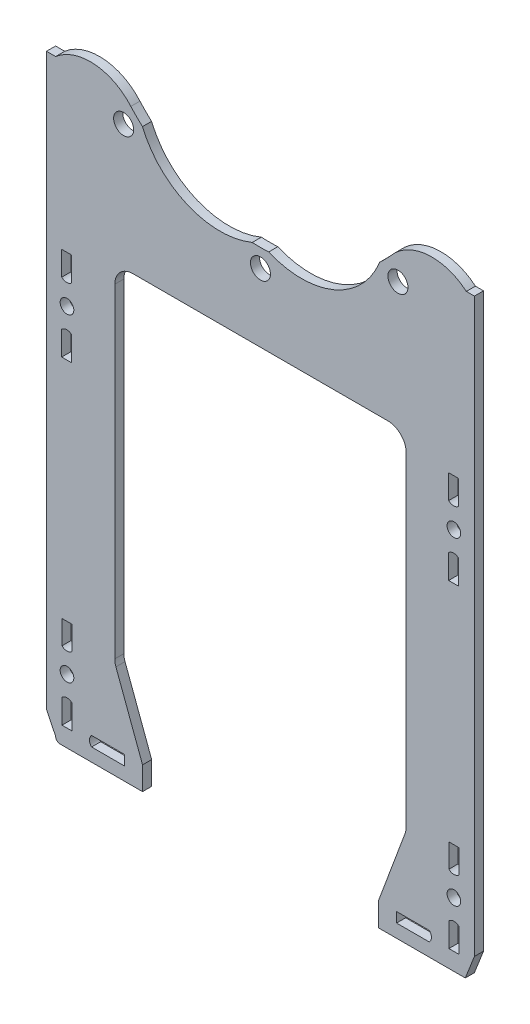
from build123d import *

# Parameters (mm, degrees)
SKETCH_3_R      = 2.2
SKETCH_3_R_2    = 1.5
EXTRUDE_1_DEPTH = 2


with BuildPart() as part:
    # 草图3 → 凸台-拉伸1 (new body)
    with BuildSketch(Plane.XY):
        with BuildLine():
            Line((-47, 31.317051182), (-47, -93.890216685))
            Line((-47, -93.890216685), (-45, -97.990216685))
            ThreePointArc((-45, -97.990216685), (-44.707106781, -98.697323466), (-44, -98.990216685))
            Line((-44, -98.990216685), (-25.9, -98.990216685))
            Line((-25.9, -98.990216685), (-25.9, -97.990216685))
            Line((-25.9, -97.990216685), (-25.9, -93.890216685))
            Line((-25.9, -93.890216685), (-31.748789112, -78.174983751))
            ThreePointArc((-31.748789112, -78.174983751), (-31.936696359, -77.488601938), (-32, -76.779784772))
            Line((-32, -76.779784772), (-32, -5.5))
            ThreePointArc((-32, -5.5), (-30.828427125, -2.671572875), (-28, -1.5))
            Line((-28, -1.5), (28, -1.5))
            ThreePointArc((28, -1.5), (30.828427125, -2.671572875), (32, -5.5))
            Line((32, -5.5), (32, -76.779784772))
            ThreePointArc((32, -76.779784772), (31.936696359, -77.488601938), (31.748789112, -78.174983751))
            Line((31.748789112, -78.174983751), (25.9, -93.890216685))
            Line((25.9, -93.890216685), (25.9, -97.990216685))
            Line((25.9, -97.990216685), (25.9, -98.990216685))
            Line((25.9, -98.990216685), (45, -98.990216685))
            Line((45, -98.990216685), (47, -93.890216685))
            Line((47, -93.890216685), (47, 31.741152315))
            Line((47, 31.741152315), (45.230037269, 31.741152315))
            ThreePointArc((45.230037269, 31.741152315), (36.686440181, 34.468680322), (28.716551195, 30.356098435))
            ThreePointArc((28.716551195, 30.356098435), (27.478316584, 29.033500084), (26.179230338, 27.770619934))
            ThreePointArc((26.179230338, 27.770619934), (16.152230905, 17.515551518), (1.809761925, 17.542559084))
            ThreePointArc((1.809761925, 17.542559084), (0, 17.5), (-1.809761925, 17.542559084))
            ThreePointArc((-1.809761925, 17.542559084), (-15.928828372, 17.542283516), (-25.912710857, 27.525776288))
            ThreePointArc((-25.912710857, 27.525776288), (-27.223611076, 28.776388924), (-28.474223712, 30.087289143))
            ThreePointArc((-28.474223712, 30.087289143), (-36.482419799, 34.124770496), (-45, 31.317051182))
            Line((-45, 31.317051182), (-47, 31.317051182))
        make_face()
        with Locations((0, 13.5)):
            Circle(SKETCH_3_R, mode=Mode.SUBTRACT)
        with Locations((-30.052038202, 25.947961669)):
            Circle(SKETCH_3_R, mode=Mode.SUBTRACT)
        with Locations((30.199957913, 26.082571452)):
            Circle(SKETCH_3_R, mode=Mode.SUBTRACT)
        with Locations((42.5, -14.940216685)):
            Circle(SKETCH_3_R_2, mode=Mode.SUBTRACT)
        with Locations(Location((-42.5, -14.940216685, 0), (0, 0, 180))):
            Circle(SKETCH_3_R_2, mode=Mode.SUBTRACT)
        with Locations((42.5, -84.940216685)):
            Circle(SKETCH_3_R_2, mode=Mode.SUBTRACT)
        with Locations((-42.5, -84.940216685)):
            Circle(SKETCH_3_R_2, mode=Mode.SUBTRACT)
        with BuildLine():
            Line((-37.1, -96.090216685), (-29.9, -96.090216685))
            Line((-29.9, -96.090216685), (-29.9, -93.890216685))
            Line((-29.9, -93.890216685), (-37.1, -93.890216685))
            ThreePointArc((-37.1, -93.890216685), (-37.555634919, -94.990216685), (-37.1, -96.090216685))
        make_face(mode=Mode.SUBTRACT)
        with BuildLine():
            Line((-41.45513954, -19.890216685), (-41.45513954, -25.190216685))
            Line((-41.45513954, -25.190216685), (-43.65513954, -25.190216685))
            Line((-43.65513954, -25.190216685), (-43.65513954, -19.890216685))
            ThreePointArc((-43.65513954, -19.890216685), (-42.55513954, -19.434581767), (-41.45513954, -19.890216685))
        make_face(mode=Mode.SUBTRACT)
        with BuildLine():
            Line((37.1, -93.890216685), (29.9, -93.890216685))
            Line((29.9, -93.890216685), (29.9, -96.090216685))
            Line((29.9, -96.090216685), (37.1, -96.090216685))
            ThreePointArc((37.1, -96.090216685), (37.555634919, -94.990216685), (37.1, -93.890216685))
        make_face(mode=Mode.SUBTRACT)
        with BuildLine():
            Line((43.54486046, -25.190216685), (43.54486046, -19.890216685))
            ThreePointArc((43.54486046, -19.890216685), (42.44486046, -19.434581767), (41.34486046, -19.890216685))
            Line((41.34486046, -19.890216685), (41.34486046, -25.190216685))
            Line((41.34486046, -25.190216685), (43.54486046, -25.190216685))
        make_face(mode=Mode.SUBTRACT)
        with BuildLine():
            Line((41.34486046, -9.990216685), (41.34486046, -4.690216685))
            Line((41.34486046, -4.690216685), (43.54486046, -4.690216685))
            Line((43.54486046, -4.690216685), (43.54486046, -9.990216685))
            ThreePointArc((43.54486046, -9.990216685), (42.44486046, -10.445851604), (41.34486046, -9.990216685))
        make_face(mode=Mode.SUBTRACT)
        with BuildLine():
            Line((43.6, -95.190216685), (43.6, -89.890216685))
            ThreePointArc((43.6, -89.890216685), (42.5, -89.434581767), (41.4, -89.890216685))
            Line((41.4, -89.890216685), (41.4, -95.190216685))
            Line((41.4, -95.190216685), (43.6, -95.190216685))
        make_face(mode=Mode.SUBTRACT)
        with BuildLine():
            Line((41.4, -74.890216685), (41.4, -80.090216685))
            ThreePointArc((41.4, -80.090216685), (42.5, -80.545851604), (43.6, -80.090216685))
            Line((43.6, -80.090216685), (43.6, -74.890216685))
            Line((43.6, -74.890216685), (41.4, -74.890216685))
        make_face(mode=Mode.SUBTRACT)
        with BuildLine():
            Line((-41.4, -95.190216685), (-41.4, -89.890216685))
            ThreePointArc((-41.4, -89.890216685), (-42.5, -89.434581767), (-43.6, -89.890216685))
            Line((-43.6, -89.890216685), (-43.6, -95.190216685))
            Line((-43.6, -95.190216685), (-41.4, -95.190216685))
        make_face(mode=Mode.SUBTRACT)
        with BuildLine():
            Line((-43.6, -74.890216685), (-43.6, -80.090216685))
            ThreePointArc((-43.6, -80.090216685), (-42.5, -80.545851604), (-41.4, -80.090216685))
            Line((-41.4, -80.090216685), (-41.4, -74.890216685))
            Line((-41.4, -74.890216685), (-43.6, -74.890216685))
        make_face(mode=Mode.SUBTRACT)
        with BuildLine():
            Line((-43.65513954, -4.690216685), (-43.65513954, -9.990216685))
            ThreePointArc((-43.65513954, -9.990216685), (-42.55513954, -10.445851604), (-41.45513954, -9.990216685))
            Line((-41.45513954, -9.990216685), (-41.45513954, -4.690216685))
            Line((-41.45513954, -4.690216685), (-43.65513954, -4.690216685))
        make_face(mode=Mode.SUBTRACT)
    extrude(amount=EXTRUDE_1_DEPTH)


solid = part.part
